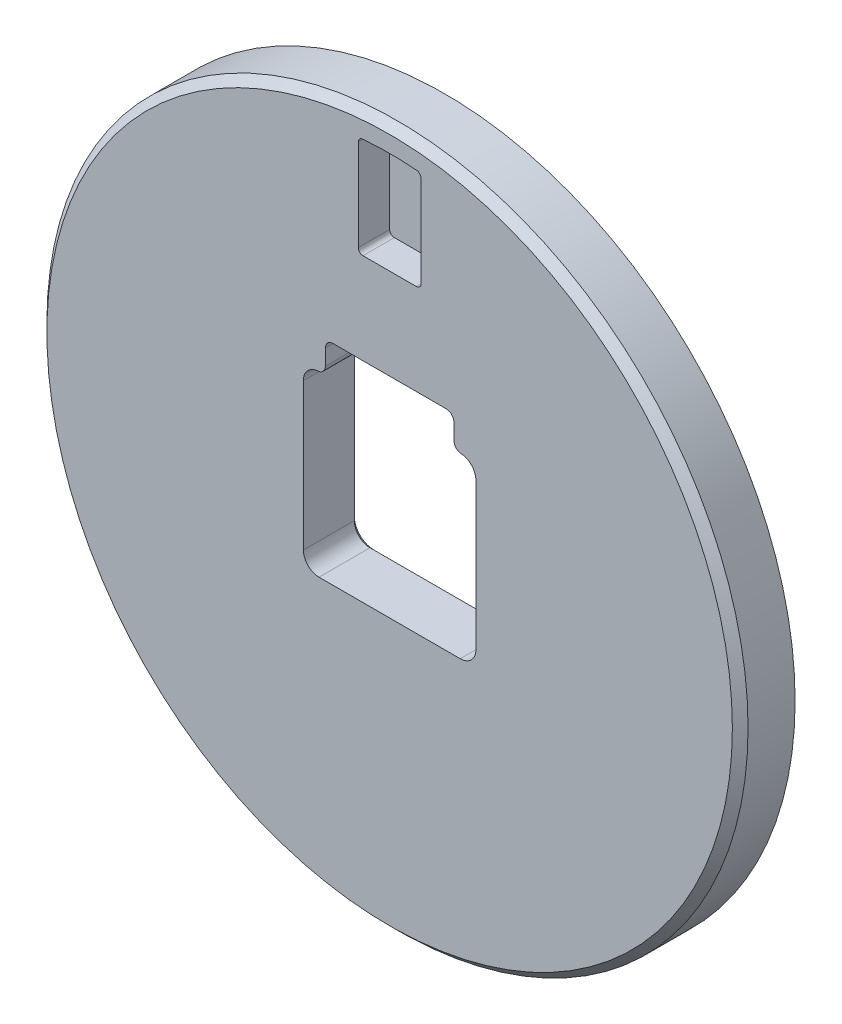
from build123d import *

# Parameters (mm, degrees)
SKETCH_1_R          = 22.35
EXTRUDE_1_DEPTH     = 3.5
CUT_EXTRUDE_START   = 3.5
CUT_EXTRUDE_1_DEPTH = 3.5
CHAMFER_1_SIZE      = 0.5
CUT_EXTRUDE_2_DEPTH = 3.5
FILLET_1_R          = 0.5
CHAMFER_2_SIZE      = 0.25
CUT_EXTRUDE_3_DEPTH = 2
FILLET_2_R          = 0.3


with BuildPart() as part:
    # 草图1 → 凸台-拉伸1 (new body)
    with BuildSketch(Plane.XY):
        Circle(SKETCH_1_R)
    extrude(amount=EXTRUDE_1_DEPTH)

    # 草图2 → 切除-拉伸1 (cut)
    with BuildSketch(Plane.XY.offset(CUT_EXTRUDE_START)):
        with BuildLine():
            Line((-5.5, 0), (-5.5, 5.5))
            ThreePointArc((-5.5, 5.5), (-5.207106781, 6.207106781), (-4.5, 6.5))
            Line((-4.5, 6.5), (4.5, 6.5))
            ThreePointArc((4.5, 6.5), (5.207106781, 6.207106781), (5.5, 5.5))
            Line((5.5, 5.5), (5.5, -3.85))
            ThreePointArc((5.5, -3.85), (5.207106781, -4.557106781), (4.5, -4.85))
            Line((4.5, -4.85), (-4.5, -4.85))
            ThreePointArc((-4.5, -4.85), (-5.207106781, -4.557106781), (-5.5, -3.85))
            Line((-5.5, -3.85), (-5.5, 0))
        make_face()
    extrude(amount=-CUT_EXTRUDE_1_DEPTH, mode=Mode.SUBTRACT)

    # 倒角1
    chamfer_1_edges = [part.edges().sort_by_distance(p)[0] for p in [
        (-22.35, 0, 3.5),
    ]]
    chamfer(chamfer_1_edges, length=CHAMFER_1_SIZE)

    # 草图3 → 切除-拉伸2 (cut)
    with BuildSketch(Plane.XY.offset(CUT_EXTRUDE_START)):
        Polygon((0, 6.5), (-4.1, 6.5), (-4.1, 8.5), (4.1, 8.5), (4.1, 6.5), align=None)
    extrude(amount=-CUT_EXTRUDE_2_DEPTH, mode=Mode.SUBTRACT)

    # 圆角1
    fillet_1_edges = [part.edges().sort_by_distance(p)[0] for p in [
        (4.1, 6.5, 1.75),
        (-4.1, 6.5, 1.75),
        (4.1, 8.5, 1.75),
        (-4.1, 8.5, 1.75),
    ]]
    fillet(fillet_1_edges, radius=FILLET_1_R)

    # 倒角2
    chamfer_2_edges = [part.edges().sort_by_distance(p)[0] for p in [
        (-5.5, 0.825, 0),
        (0, -4.85, 0),
        (5.5, 0.825, 0),
        (-5.230296743, 6.183130051, 0),
        (5.207106781, -4.557106781, 0),
        (-5.207106781, -4.557106781, 0),
        (4.1, 7.498331477, 0),
        (5.230296743, 6.183130051, 0),
        (-4.1, 7.498331477, 0),
        (0, 8.5, 0),
        (-4.234851628, 6.655097929, 0),
        (4.234851628, 6.655097929, 0),
        (3.953553391, 8.353553391, 0),
        (-3.953553391, 8.353553391, 0),
    ]]
    chamfer(chamfer_2_edges, length=CHAMFER_2_SIZE)

    # 草图4 → 切除-拉伸3 (cut)
    with BuildSketch(Plane.XY.offset(CUT_EXTRUDE_START)):
        with BuildLine():
            Line((-2, 20.7), (-2, 19.7))
            Line((-2, 19.7), (-2, 14.3))
            Line((-2, 14.3), (0, 14.3))
            Line((0, 14.3), (2, 14.3))
            Line((2, 14.3), (2, 19.7))
            Line((2, 19.7), (2, 20.7))
            ThreePointArc((2, 20.7), (0, 20.801262586), (-2, 20.7))
        make_face()
    extrude(amount=-CUT_EXTRUDE_3_DEPTH, mode=Mode.SUBTRACT)

    # 圆角2
    fillet_2_edges = [part.edges().sort_by_distance(p)[0] for p in [
        (-2, 20.7, 2.5),
        (2, 20.7, 2.5),
        (2, 14.3, 2.5),
        (-2, 14.3, 2.5),
    ]]
    fillet(fillet_2_edges, radius=FILLET_2_R)


solid = part.part
